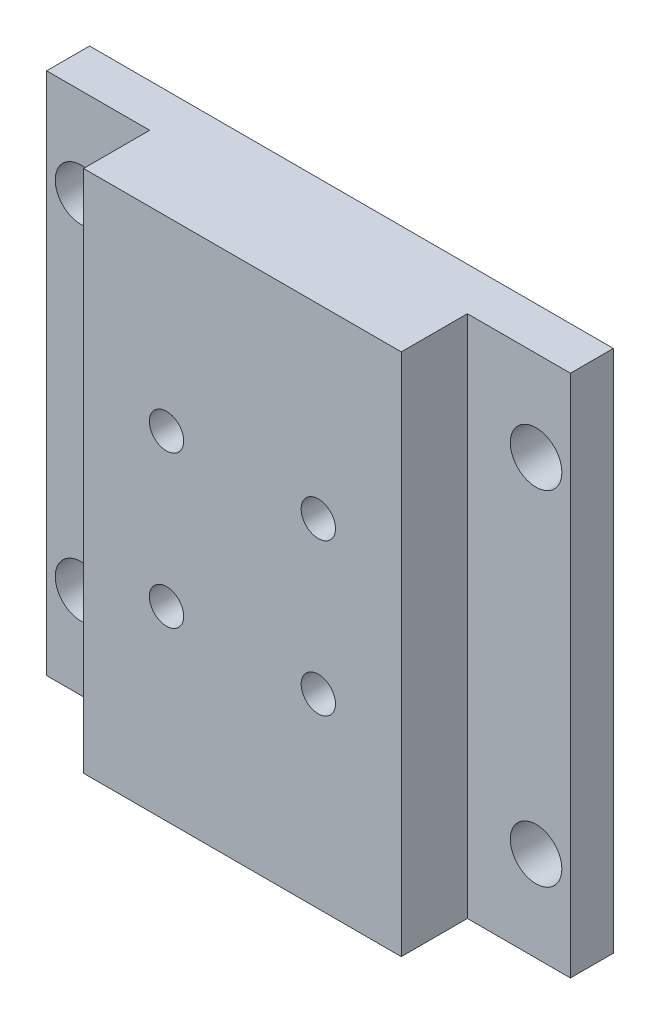
from build123d import *

# Parameters (mm, degrees)
SKETCH1_W           = 61
SKETCH1_H           = 61
BOSS_EXTRUDE1_DEPTH = 12.7
SKETCH2_R           = 2
CUT_EXTRUDE1_DEPTH  = 45.964319188
SKETCH3_R           = 3
CUT_EXTRUDE2_DEPTH  = 45.964319188
SKETCH4_W           = 12
SKETCH4_H           = 61
CUT_EXTRUDE3_DEPTH  = 7.7


with BuildPart() as part:
    # Sketch1 → Boss-Extrude1 (new body)
    with BuildSketch(Plane.XY):
        Rectangle(SKETCH1_W, SKETCH1_H)
    extrude(amount=-BOSS_EXTRUDE1_DEPTH)

    # Sketch2 → Cut-Extrude1 (cut, through all)
    with BuildSketch(Plane.XY):
        with Locations((8.838834765, 8.838834765)):
            Circle(SKETCH2_R)
        with Locations((-8.838834765, 8.838834765)):
            Circle(SKETCH2_R)
        with Locations((-8.838834765, -8.838834765)):
            Circle(SKETCH2_R)
        with Locations((8.838834765, -8.838834765)):
            Circle(SKETCH2_R)
    extrude(amount=-CUT_EXTRUDE1_DEPTH, mode=Mode.SUBTRACT)

    # Sketch3 → Cut-Extrude2 (cut, through all)
    with BuildSketch(Plane.XY):
        with Locations((26.5, 20)):
            Circle(SKETCH3_R)
        with Locations((26.5, -20)):
            Circle(SKETCH3_R)
        with Locations((-26.5, 20)):
            Circle(SKETCH3_R)
        with Locations((-26.5, -20)):
            Circle(SKETCH3_R)
    extrude(amount=-CUT_EXTRUDE2_DEPTH, mode=Mode.SUBTRACT)

    # Sketch4 → Cut-Extrude3 (cut)
    with BuildSketch(Plane.XY):
        with Locations((-24.5, 0)):
            Rectangle(SKETCH4_W, SKETCH4_H)
        with Locations((24.5, 0)):
            Rectangle(SKETCH4_W, SKETCH4_H)
    extrude(amount=-CUT_EXTRUDE3_DEPTH, mode=Mode.SUBTRACT)


solid = part.part
